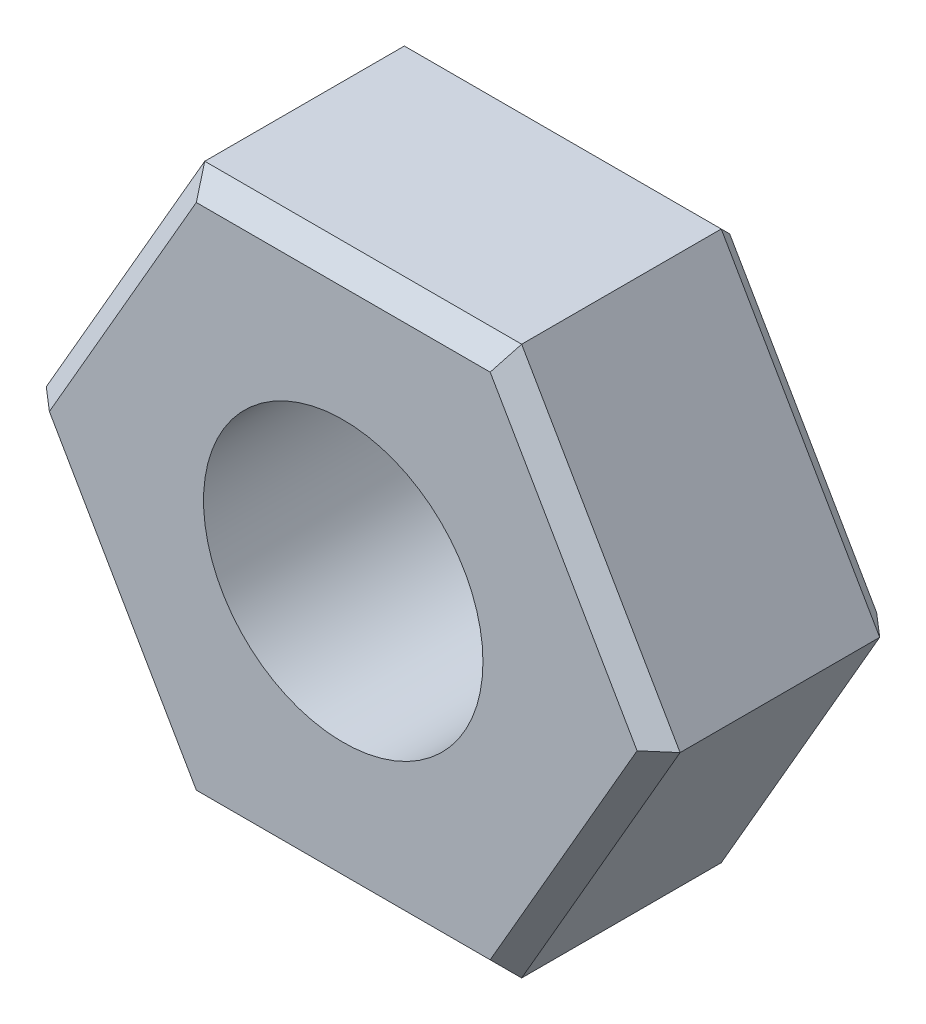
from build123d import *

# Parameters (mm, degrees)
NUT_HEX_EXTRUDE_DEPTH  = 2.4
HEX_EDGE_CHAMFERS_SIZE = 0.2
THREAD_BORE_SKETCH_R   = 1.4
THREAD_BORE_CUT_DEPTH  = 5.837957558


with BuildPart() as part:
    # Nut Hex Sketch → Nut Hex Extrude (new body)
    with BuildSketch(Plane.XY):
        Polygon((3.175426481, 0), (1.58771324, 2.75), (-1.58771324, 2.75), (-3.175426481, 0), (-1.58771324, -2.75), (1.58771324, -2.75), align=None)
    extrude(amount=NUT_HEX_EXTRUDE_DEPTH)

    # Hex Edge Chamfers
    hex_edge_chamfers_edges = [part.edges().sort_by_distance(p)[0] for p in [
        (0, 2.75, 2.4),
        (-2.38156986, 1.375, 2.4),
        (-2.38156986, -1.375, 2.4),
        (0, -2.75, 2.4),
        (2.38156986, -1.375, 2.4),
        (0, -2.75, 0),
        (-2.38156986, -1.375, 0),
        (-2.38156986, 1.375, 0),
        (0, 2.75, 0),
        (2.38156986, 1.375, 0),
        (2.38156986, -1.375, 0),
        (2.38156986, 1.375, 2.4),
    ]]
    chamfer(hex_edge_chamfers_edges, length=HEX_EDGE_CHAMFERS_SIZE)

    # Thread Bore Sketch → Thread Bore Cut (cut, through all)
    with BuildSketch(Plane.XY):
        Circle(THREAD_BORE_SKETCH_R)
    extrude(amount=THREAD_BORE_CUT_DEPTH, mode=Mode.SUBTRACT)


solid = part.part
